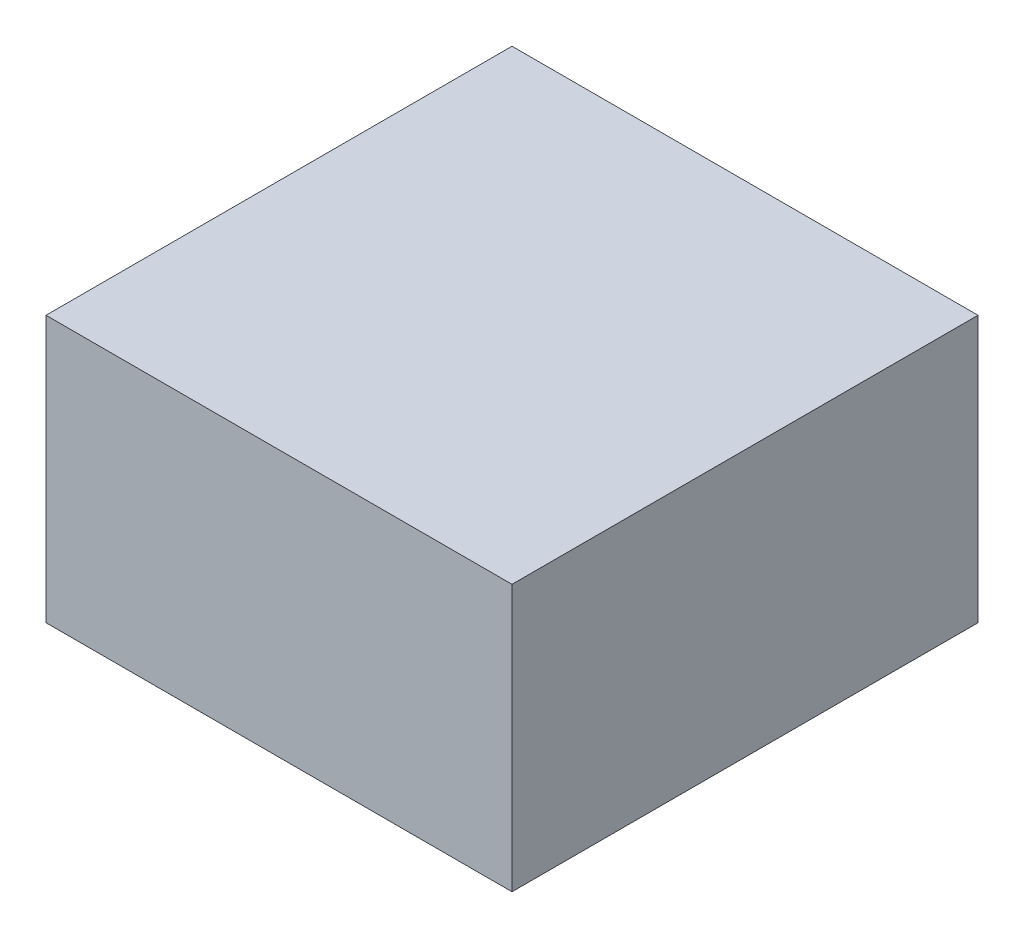
from build123d import *

# Parameters (mm, degrees)
SKETCH2_W           = 177.8
SKETCH2_H           = 177.8
BOSS_EXTRUDE1_DEPTH = 101.6


with BuildPart() as part:
    # Sketch2 → Boss-Extrude1 (new body)
    with BuildSketch(Plane(origin=(0, 0, 0), x_dir=(1, 0, 0), z_dir=(0, 1, 0))):
        Rectangle(SKETCH2_W, SKETCH2_H)
    extrude(amount=BOSS_EXTRUDE1_DEPTH)


solid = part.part
